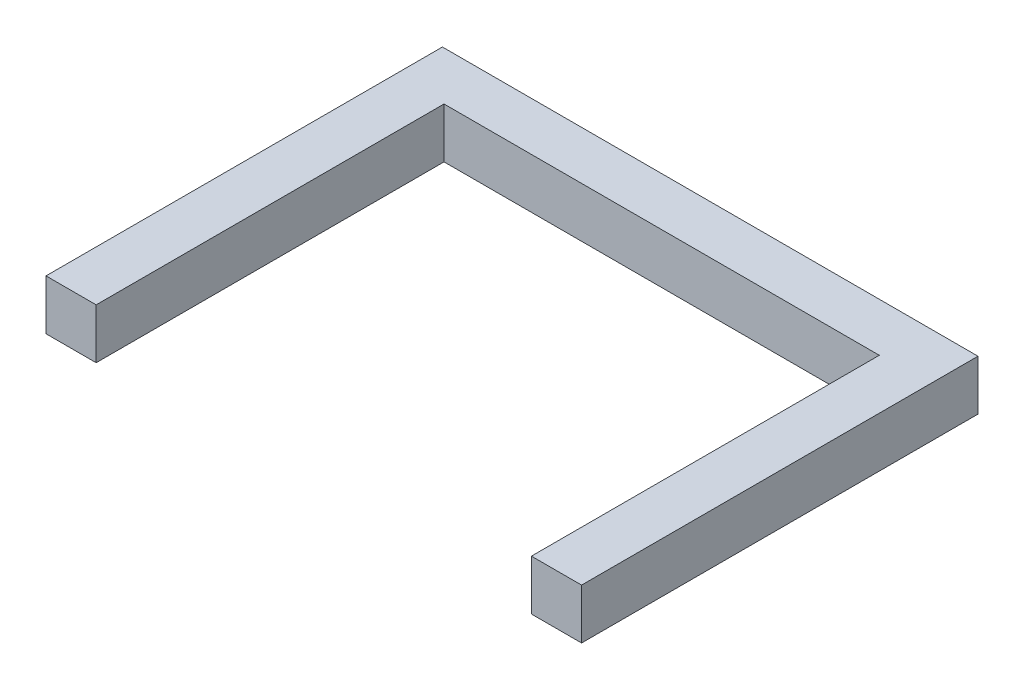
from build123d import *

# Parameters (mm, degrees)
BOSS_EXTRUDE1_DEPTH = 3.1


with BuildPart() as part:
    # Sketch1 → Boss-Extrude1 (new body)
    with BuildSketch(Plane(origin=(0, 0, 0), x_dir=(1, 0, 0), z_dir=(0, 1, 0))):
        Polygon((0, 0), (0, 24.5), (33.1, 24.5), (33.1, 0), (30, 0), (30, 21.5), (3.1, 21.5), (3.1, 0), align=None)
    extrude(amount=BOSS_EXTRUDE1_DEPTH)


solid = part.part
